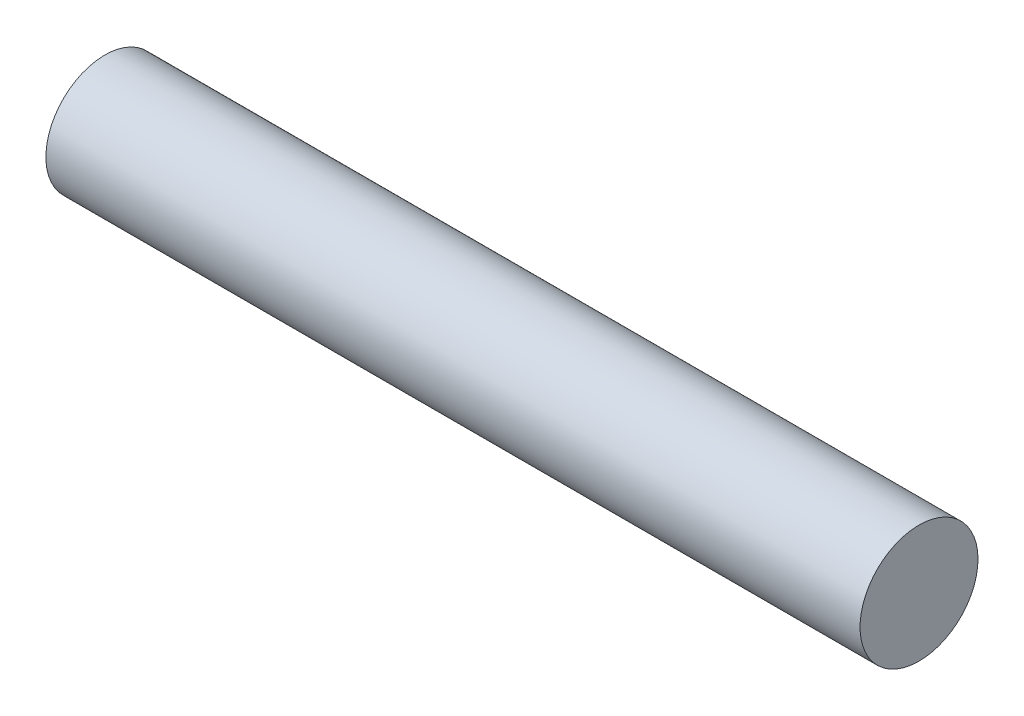
from build123d import *

# Parameters (mm, degrees)
SKETCH2_R           = 1.5
BOSS_EXTRUDE1_DEPTH = 20.71


with BuildPart() as part:
    # Sketch2 → Boss-Extrude1 (new body)
    with BuildSketch(Plane(origin=(0, 0, 0), x_dir=(0, 0, -1), z_dir=(1, 0, 0))):
        Circle(SKETCH2_R)
    extrude(amount=BOSS_EXTRUDE1_DEPTH)


solid = part.part
